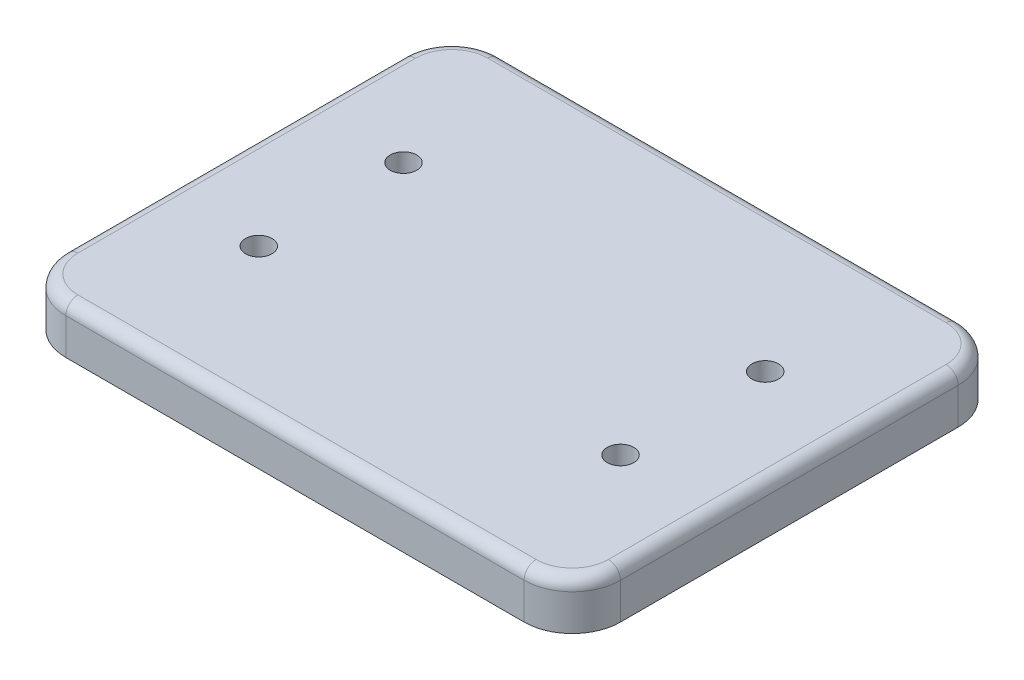
from build123d import *

# Parameters (mm, degrees)
BOSS_EXTRUDE1_DEPTH = 20
FILLET1_R           = 5
SKETCH2_R           = 5.5
CUT_EXTRUDE1_DEPTH  = 148.39402973
SKETCH3_R           = 9
CUT_EXTRUDE4_DEPTH  = 11


with BuildPart() as part:
    # Sketch1 → Boss-Extrude1 (new body)
    with BuildSketch(Plane(origin=(0, 0, 0), x_dir=(1, 0, 0), z_dir=(0, 1, 0))):
        with BuildLine():
            Line((95, 90), (-95, 90))
            ThreePointArc((-95, 90), (-109.142135624, 84.142135624), (-115, 70))
            Line((-115, 70), (-115, -70))
            ThreePointArc((-115, -70), (-109.142135624, -84.142135624), (-95, -90))
            Line((-95, -90), (95, -90))
            ThreePointArc((95, -90), (109.142135624, -84.142135624), (115, -70))
            Line((115, -70), (115, 70))
            ThreePointArc((115, 70), (109.142135624, 84.142135624), (95, 90))
        make_face()
    extrude(amount=BOSS_EXTRUDE1_DEPTH)

    # Fillet1
    fillet1_edges = [part.edges().sort_by_distance(p)[0] for p in [
        (-109.142135624, 20, 84.142135624),
        (0, 20, 90),
        (109.142135624, 20, 84.142135624),
        (115, 20, 0),
        (109.142135624, 20, -84.142135624),
        (0, 20, -90),
        (-109.142135624, 20, -84.142135624),
        (-115, 20, 0),
    ]]
    fillet(fillet1_edges, radius=FILLET1_R)

    # Sketch2 → Cut-Extrude1 (cut, through all)
    with BuildSketch(Plane(origin=(0, 20, 0), x_dir=(1, 0, 0), z_dir=(0, 1, 0))):
        with Locations(Location((-75, 30, 0), (0, 0, 270))):
            Circle(SKETCH2_R)
        with Locations(Location((75, 30, 0), (0, 0, 270))):
            Circle(SKETCH2_R)
    cut_extrude1 = extrude(amount=-CUT_EXTRUDE1_DEPTH, mode=Mode.SUBTRACT)

    # Sketch3 → Cut-Extrude4 (cut)
    with BuildSketch(Plane.XZ):
        with Locations(Location((-75, -30, 0), (0, 0, 270))):
            Circle(SKETCH3_R)
        with Locations(Location((75, -30, 0), (0, 0, 270))):
            Circle(SKETCH3_R)
    cut_extrude4 = extrude(amount=-CUT_EXTRUDE4_DEPTH, mode=Mode.SUBTRACT)

    # Mirror1: Cut-Extrude1, Cut-Extrude4 across plane
    add(cut_extrude1.mirror(Plane.XY), mode=Mode.SUBTRACT)
    add(cut_extrude4.mirror(Plane.XY), mode=Mode.SUBTRACT)


solid = part.part
